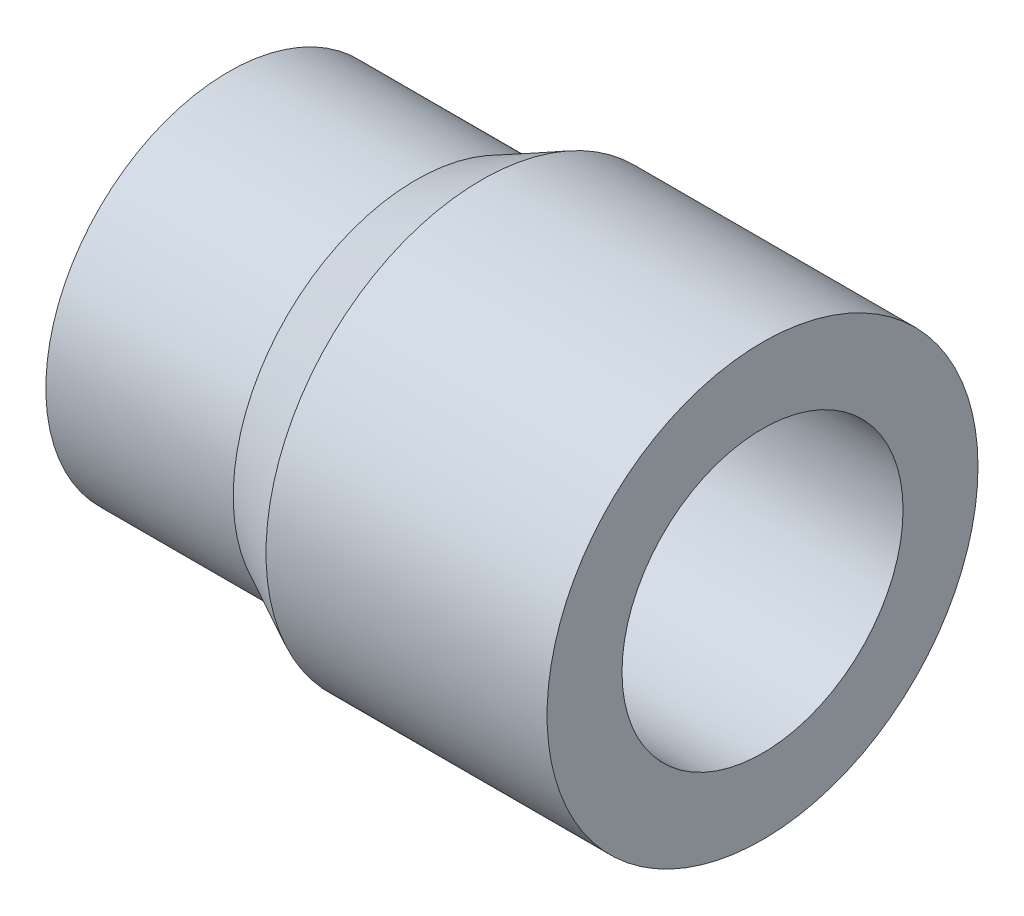
from build123d import *


with BuildPart() as part:
    # Croquis1 → Revolución1 (revolve)
    with BuildSketch(Plane(origin=(0, 0, 0), x_dir=(-1, 0, 0), z_dir=(0, 1, 0)), mode=Mode.PRIVATE) as revoluci_n1_sk:
        Polygon((0, 2.3), (0, 1.5), (5.7, 1.5), (5.7, 1.95), (3.7, 1.95), (3, 2.3), align=None)
    revolve(revoluci_n1_sk.sketch.rotate(Axis((0, 0, 0), (-1, 0, 0)), 180), axis=Axis((0, 0, 0), (-1, 0, 0)))


solid = part.part
